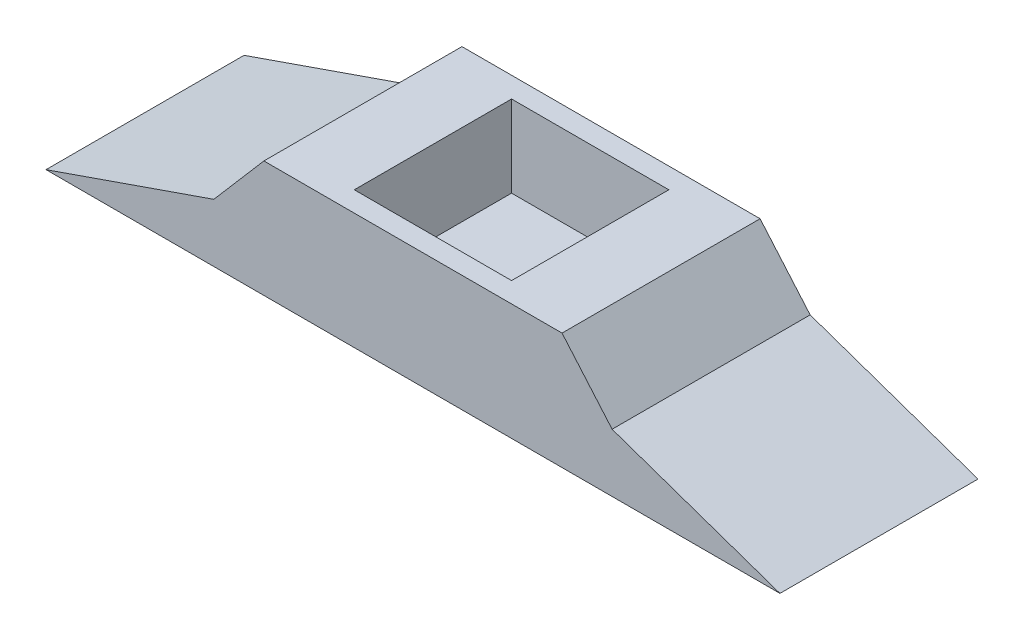
from build123d import *

# Parameters (mm, degrees)
EXTRUDE_2_DEPTH     = 1.7
CUT_EXTRUDE_START   = 0.3
SKETCH_3_W          = 1.35
SKETCH_3_H          = 1.35
CUT_EXTRUDE_2_DEPTH = 1
SCALE_1_SCALE       = 10


with BuildPart() as part:
    # 스케치1 → 보스-돌출2 (new body)
    with BuildSketch(Plane.XY):
        Polygon((-3.15, 0), (3.15, 0), (1.709287021, 0.5), (1.279556076, 1), (-1.279556076, 1), (-1.709287021, 0.5), align=None)
    extrude(amount=EXTRUDE_2_DEPTH)

    # 스케치3 → 컷-돌출2 (cut)
    with BuildSketch(Plane(origin=(0, 1, 0), x_dir=(1, 0, 0), z_dir=(0, 1, 0)).offset(CUT_EXTRUDE_START)):
        with Locations((-0.002241196, -0.851457908)):
            Rectangle(SKETCH_3_W, SKETCH_3_H)
    extrude(amount=-CUT_EXTRUDE_2_DEPTH, mode=Mode.SUBTRACT)


with BuildPart() as part_1:
    # 축척1: scaled about (0.000529957, 0.366302106, 0.84965526)
    add(part.part.scale(SCALE_1_SCALE).moved(Location((-0.004769613, -3.296718954, -7.64689734))))


solid = part_1.part
